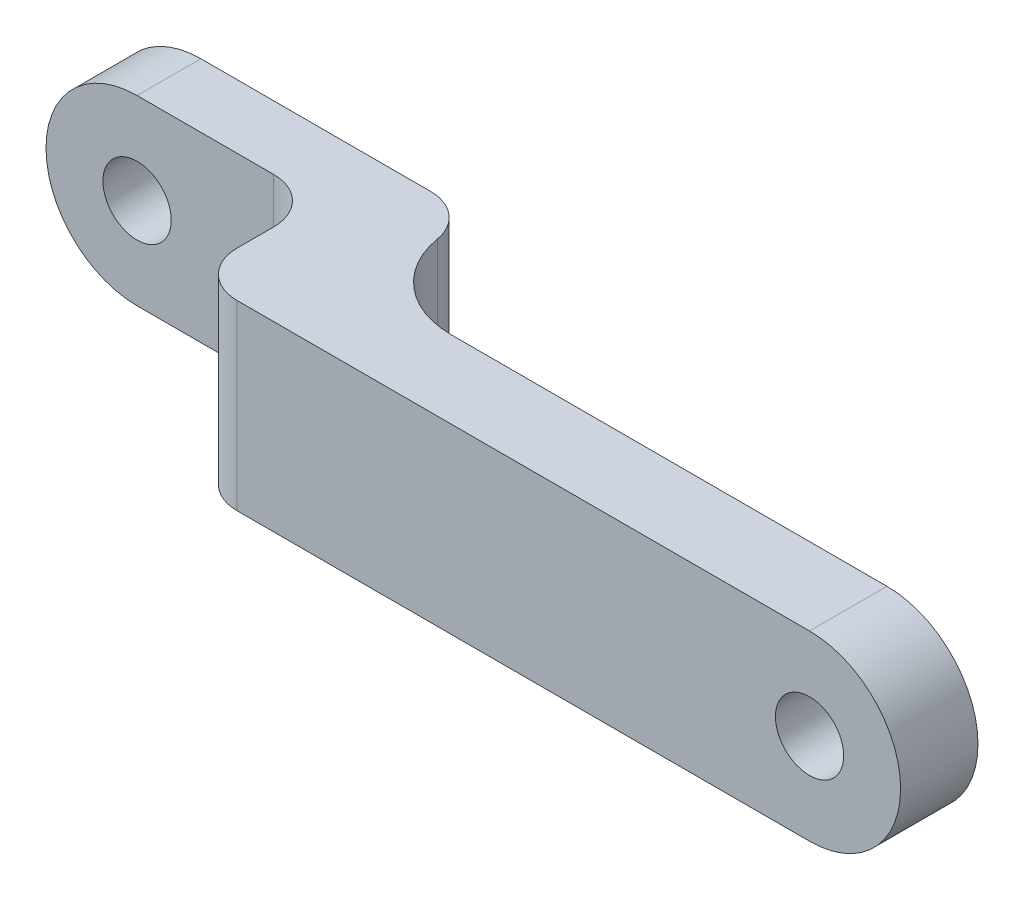
from build123d import *

# Parameters (mm, degrees)
SKETCH1_R           = 0.75
BOSS_EXTRUDE1_DEPTH = 0.85
SKETCH2_R           = 0.75
BOSS_EXTRUDE2_DEPTH = 2.5
SKETCH3_R           = 0.75
CUT_EXTRUDE1_DEPTH  = 2.8
FILLET1_R           = 2
FILLET2_R           = 1
FILLET3_R           = 1


with BuildPart() as part:
    # Sketch1 → Boss-Extrude1 (new, symmetric)
    with BuildSketch(Plane.XY):
        with BuildLine():
            Line((0, 2), (17.57, 2))
            ThreePointArc((17.57, 2), (19.57, 0), (17.57, -2))
            Line((17.57, -2), (0, -2))
            ThreePointArc((0, -2), (-2, 0), (0, 2))
        make_face()
        Circle(SKETCH1_R, mode=Mode.SUBTRACT)
        with Locations((17.57, 0)):
            Circle(SKETCH1_R, mode=Mode.SUBTRACT)
    extrude(amount=BOSS_EXTRUDE1_DEPTH, both=True)

    # Sketch2 → Boss-Extrude2 (add)
    with BuildSketch(Plane(origin=(0, 0, -0.85), x_dir=(-1, 0, 0), z_dir=(0, 0, -1))):
        with BuildLine():
            Line((-6, 2), (-6, -2))
            Line((-6, -2), (0, -2))
            ThreePointArc((0, -2), (2, 0), (0, 2))
            Line((0, 2), (-6, 2))
        make_face()
        Circle(SKETCH2_R, mode=Mode.SUBTRACT)
    extrude(amount=BOSS_EXTRUDE2_DEPTH)

    # Sketch3 → Cut-Extrude1 (cut)
    with BuildSketch(Plane.XY.offset(0.85)):
        with BuildLine():
            Line((4, 2), (4, -2))
            Line((4, -2), (0, -2))
            ThreePointArc((0, -2), (-2, 0), (0, 2))
            Line((0, 2), (4, 2))
        make_face()
        with Locations(Location((0, 0, 0), (0, 0, 180))):
            Circle(SKETCH3_R, mode=Mode.SUBTRACT)
    extrude(amount=-CUT_EXTRUDE1_DEPTH, mode=Mode.SUBTRACT)

    # Fillet1
    fillet1_edges = [part.edges().sort_by_distance(p)[0] for p in [
        (6, 0, -0.85),
    ]]
    fillet(fillet1_edges, radius=FILLET1_R)

    # Fillet2
    fillet2_edges = [part.edges().sort_by_distance(p)[0] for p in [
        (6, 0, -3.35),
    ]]
    fillet(fillet2_edges, radius=FILLET2_R)

    # Fillet3
    fillet3_edges = [part.edges().sort_by_distance(p)[0] for p in [
        (4, 0, -1.95),
        (4, 0, 0.85),
    ]]
    fillet(fillet3_edges, radius=FILLET3_R)


solid = part.part
